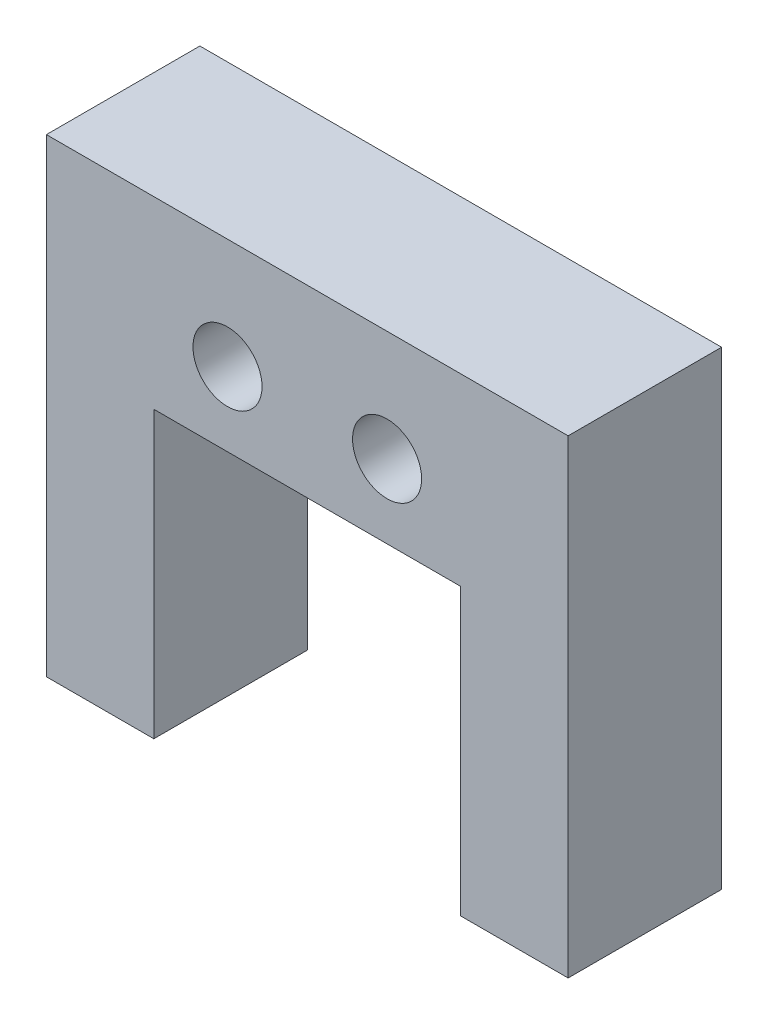
from build123d import *

# Parameters (mm, degrees)
SKETCH1_R           = 2.25
BOSS_EXTRUDE1_DEPTH = 10


with BuildPart() as part:
    # Sketch1 → Boss-Extrude1 (new body)
    with BuildSketch(Plane.XY):
        Polygon((27, 0), (34, 0), (34, 30.6), (0, 30.6), (0, 0), (7, 0), (7, 18.6), (27, 18.6), align=None)
        with Locations((22.2, 23.4)):
            Circle(SKETCH1_R, mode=Mode.SUBTRACT)
        with Locations((11.8, 23.4)):
            Circle(SKETCH1_R, mode=Mode.SUBTRACT)
    extrude(amount=BOSS_EXTRUDE1_DEPTH)


solid = part.part
